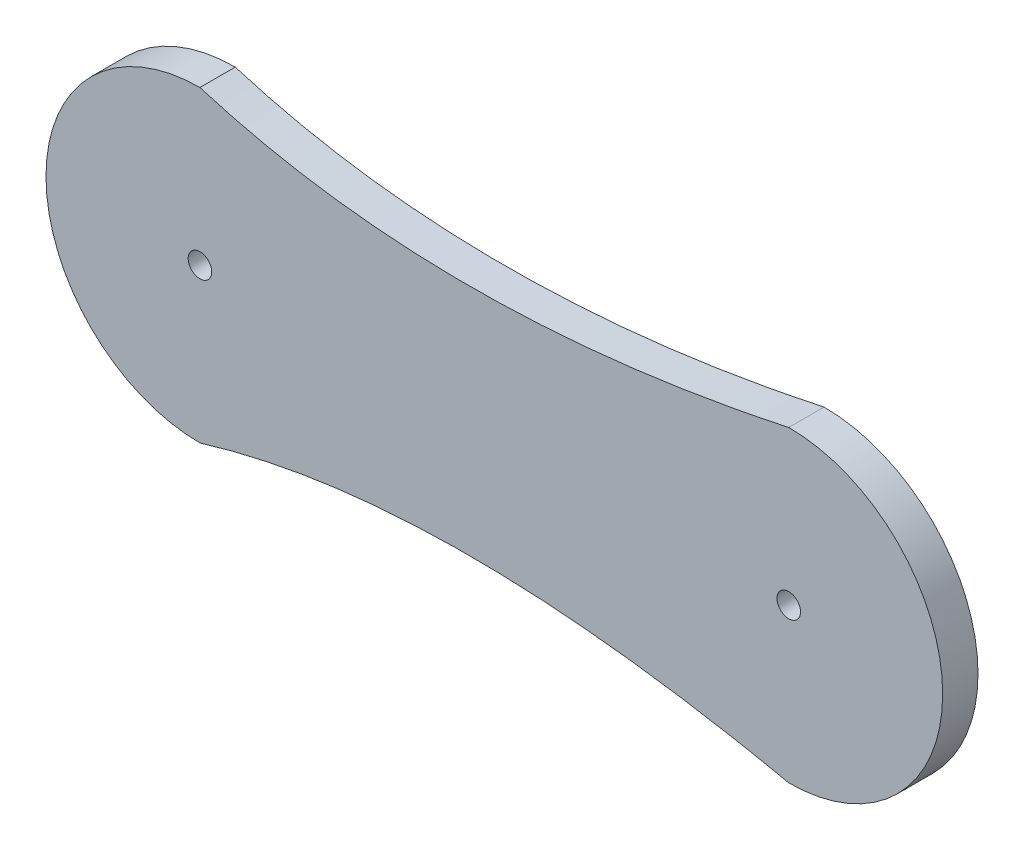
from build123d import *

# Parameters (mm, degrees)
SKETCH1_R           = 1
BOSS_EXTRUDE1_DEPTH = 3


with BuildPart() as part:
    # Sketch1 → Boss-Extrude1 (new body)
    # profile 1 of 6: a face of its own
    with BuildSketch(Plane.XY):
        with BuildLine():
            ThreePointArc((-24.781290204, -3.3929583), (-28.4, 0), (-24.781290204, 3.3929583))
            Line((-24.781290204, 3.3929583), (-12.188441083, 2.581224344))
            ThreePointArc((-12.188441083, 2.581224344), (-14.492522891, 7.771208774), (-18.780288742, 11.494083385))
            add(Edge.make_bspline(
                [(-25, 13.069), (-21.982355601, 12.146946089), (-18.780288742, 11.494083385)],
                knots=[0, 0, 0, 0.145973682, 0.145973682, 0.145973682], degree=2))
            ThreePointArc((-25, 13.069), (-38.069, 0), (-25, -13.069))
            add(Edge.make_bspline(
                [(-25, -13.069), (-21.982355601, -12.146946089), (-18.780288742, -11.494083385)],
                knots=[0, 0, 0, 0.145973682, 0.145973682, 0.145973682], degree=2))
            ThreePointArc((-18.780288742, -11.494083385), (-14.492522891, -7.771208774), (-12.188441083, -2.581224344))
            Line((-12.188441083, -2.581224344), (-24.781290204, -3.3929583))
        make_face()
    # profile 2 of 6: a face of its own
    with BuildSketch(Plane.XY):
        with BuildLine():
            ThreePointArc((-18.780288742, 11.494083385), (-14.492522891, 7.771208774), (-12.188441083, 2.581224344))
            Line((-12.188441083, 2.581224344), (-3.107347179, 1.995857823))
            ThreePointArc((-3.107347179, 1.995857823), (-1.236, 0), (-3.107347179, -1.995857823))
            Line((-3.107347179, -1.995857823), (-12.188441083, -2.581224344))
            ThreePointArc((-12.188441083, -2.581224344), (-14.492522891, -7.771208774), (-18.780288742, -11.494083385))
            add(Edge.make_bspline(
                [(-18.780288742, -11.494083385), (-1.944343038, -8.061437688), (19.989933944, -12.070542619)],
                knots=[0.145973682, 0.145973682, 0.145973682, 0.91347951, 0.91347951, 0.91347951], degree=2))
            ThreePointArc((19.989933944, -12.070542619), (14.904735293, -8.299662132), (12.188441083, -2.581224344))
            Line((12.188441083, -2.581224344), (3.107347179, -1.995857823))
            ThreePointArc((3.107347179, -1.995857823), (1.236, 0), (3.107347179, 1.995857823))
            Line((3.107347179, 1.995857823), (12.188441083, 2.581224344))
            ThreePointArc((12.188441083, 2.581224344), (14.904735293, 8.299662132), (19.989933944, 12.070542619))
            add(Edge.make_bspline(
                [(-18.780288742, 11.494083385), (-1.944343038, 8.061437688), (19.989933944, 12.070542619)],
                knots=[0.145973682, 0.145973682, 0.145973682, 0.91347951, 0.91347951, 0.91347951], degree=2))
        make_face()
    # profile 3 of 6: a face of its own
    with BuildSketch(Plane.XY):
        with BuildLine():
            add(Edge.make_bspline(
                [(19.989933944, 12.070542619), (22.462572371, 12.522486712), (25, 13.069)],
                knots=[0.91347951, 0.91347951, 0.91347951, 1, 1, 1], degree=2))
            ThreePointArc((19.989933944, 12.070542619), (14.904735293, 8.299662132), (12.188441083, 2.581224344))
            Line((12.188441083, 2.581224344), (24.781290204, 3.3929583))
            ThreePointArc((24.781290204, 3.3929583), (28.4, 0), (24.781290204, -3.3929583))
            Line((24.781290204, -3.3929583), (12.188441083, -2.581224344))
            ThreePointArc((12.188441083, -2.581224344), (14.904735293, -8.299662132), (19.989933944, -12.070542619))
            add(Edge.make_bspline(
                [(19.989933944, -12.070542619), (22.462572371, -12.522486712), (25, -13.069)],
                knots=[0.91347951, 0.91347951, 0.91347951, 1, 1, 1], degree=2))
            ThreePointArc((25, -13.069), (34.241178523, -9.241178523), (38.069, 0))
            ThreePointArc((38.069, 0), (34.241178523, 9.241178523), (25, 13.069))
        make_face()
    # profile 4 of 6: a face of its own
    with BuildSketch(Plane.XY):
        with BuildLine():
            Line((24.781290204, 3.3929583), (12.188441083, 2.581224344))
            ThreePointArc((12.188441083, 2.581224344), (11.931, 0), (12.188441083, -2.581224344))
            Line((12.188441083, -2.581224344), (24.781290204, -3.3929583))
            ThreePointArc((24.781290204, -3.3929583), (28.4, 0), (24.781290204, 3.3929583))
        make_face()
        with Locations((25, 0)):
            Circle(SKETCH1_R, mode=Mode.SUBTRACT)
    # profile 5 of 6: a face of its own
    with BuildSketch(Plane.XY):
        with BuildLine():
            ThreePointArc((12.188441083, -2.581224344), (11.931, 0), (12.188441083, 2.581224344))
            Line((12.188441083, 2.581224344), (3.107347179, 1.995857823))
            ThreePointArc((3.107347179, 1.995857823), (1.236, 0), (3.107347179, -1.995857823))
            Line((3.107347179, -1.995857823), (12.188441083, -2.581224344))
        make_face()
    # profile 6 of 6: a face of its own
    with BuildSketch(Plane.XY):
        with BuildLine():
            Line((-24.781290204, -3.3929583), (-3.107347179, -1.995857823))
            ThreePointArc((-3.107347179, -1.995857823), (-1.236, 0), (-3.107347179, 1.995857823))
            Line((-3.107347179, 1.995857823), (-24.781290204, 3.3929583))
            ThreePointArc((-24.781290204, 3.3929583), (-28.4, 0), (-24.781290204, -3.3929583))
        make_face()
        with Locations((-25, 0)):
            Circle(SKETCH1_R, mode=Mode.SUBTRACT)
    extrude(amount=BOSS_EXTRUDE1_DEPTH)


solid = part.part
